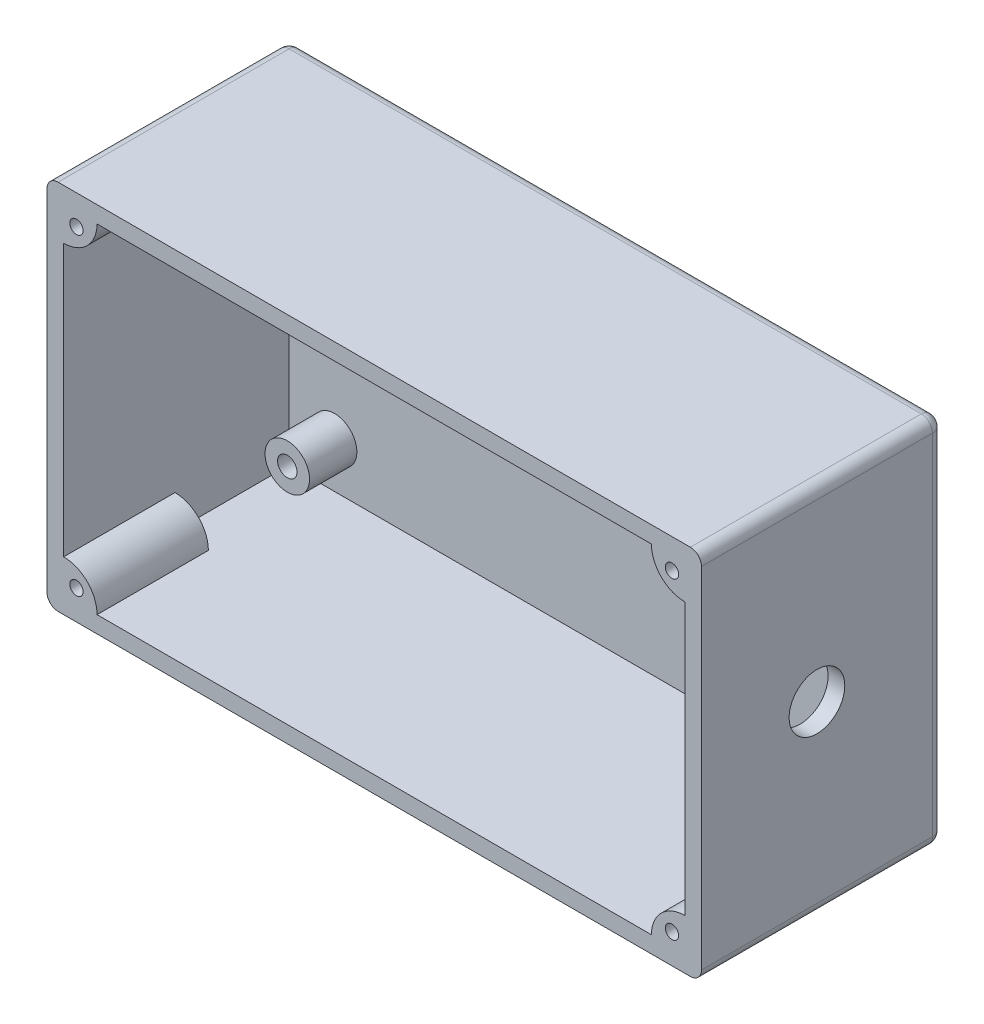
from build123d import *

# Parameters (mm, degrees)
SCHIZZO1_W                           = 117.6
SCHIZZO1_H                           = 66.8
ESTRUSIONE_ESTRUSIONE1_DEPTH         = 3
SCHIZZO2_W                           = 117.6
SCHIZZO2_H                           = 66.8
SCHIZZO2_W_2                         = 111.6
SCHIZZO2_H_2                         = 60.8
ESTRUSIONE_FORI_COVER_DEPTH          = 40.5
SCHIZZO4_R                           = 4
SCHIZZO4_R_2                         = 1.75
ESTRUSIONE_FORI_PCB_DEPTH            = 8.5
SCHIZZO7_R                           = 3.5
ESTRUSIONE_FORI_CHASSIS_DEPTH        = 1
SCHIZZO8_R                           = 1.85
TAGLIO_ESTRUSIONE2_DEPTH             = 79.82417142
TAGLIO_ESTRUSIONE2_DIRECTION_2_REACH = 80.824
RACCORDO3_R                          = 2
RACCORDO4_R                          = 2
RACCORDO5_R                          = 2
RACCORDO6_R                          = 2
RACCORDO7_R                          = 2
SCHIZZO9_R                           = 1.2
ESTRUSIONE_ESTRUSIONE6_DEPTH         = 20
TAGLIO_FORO_CAVI_REACH               = 131.76
SCHIZZO11_R                          = 5


with BuildPart() as part:
    # Schizzo1 → Estrusione-Estrusione1 (new body)
    with BuildSketch(Plane.XY):
        Rectangle(SCHIZZO1_W, SCHIZZO1_H)
    extrude(amount=ESTRUSIONE_ESTRUSIONE1_DEPTH)

    # Schizzo2 → Estrusione- Fori Cover (add)
    with BuildSketch(Plane.XY.offset(3)):
        Rectangle(SCHIZZO2_W, SCHIZZO2_H)
        Rectangle(SCHIZZO2_W_2, SCHIZZO2_H_2, mode=Mode.SUBTRACT)
    extrude(amount=ESTRUSIONE_FORI_COVER_DEPTH)

    # Schizzo4 → Estrusione- Fori PCB (add)
    # profile 1 of 4: a face of its own
    with BuildSketch(Plane.XY.offset(3)):
        with Locations(Location((-47.62, 22.2, 0), (0, 0, 180))):
            Circle(SCHIZZO4_R)
        with Locations((-47.62, 22.2)):
            Circle(SCHIZZO4_R_2, mode=Mode.SUBTRACT)
    # profile 2 of 4: a face of its own
    with BuildSketch(Plane.XY.offset(3)):
        with Locations(Location((47.63, 22.2, 0), (0, 0, 180))):
            Circle(SCHIZZO4_R)
        with Locations((47.63, 22.2)):
            Circle(SCHIZZO4_R_2, mode=Mode.SUBTRACT)
    # profile 3 of 4: a face of its own
    with BuildSketch(Plane.XY.offset(3)):
        with Locations(Location((47.63, -22.25, 0), (0, 0, 180))):
            Circle(SCHIZZO4_R)
        with Locations((47.63, -22.25)):
            Circle(SCHIZZO4_R_2, mode=Mode.SUBTRACT)
    # profile 4 of 4: a face of its own
    with BuildSketch(Plane.XY.offset(3)):
        with Locations(Location((-47.62, -22.25, 0), (0, 0, 180))):
            Circle(SCHIZZO4_R)
        with Locations((-47.62, -22.25)):
            Circle(SCHIZZO4_R_2, mode=Mode.SUBTRACT)
    extrude(amount=ESTRUSIONE_FORI_PCB_DEPTH)

    # Schizzo7 → Estrusione-Fori Chassis (add)
    with BuildSketch(Plane.XY.offset(3)):
        with Locations(Location((-48.8, 0, 0), (0, 0, 180))):
            Circle(SCHIZZO7_R)
        with Locations(Location((48.8, 0, 0), (0, 0, 180))):
            Circle(SCHIZZO7_R)
    extrude(amount=ESTRUSIONE_FORI_CHASSIS_DEPTH)

    # Schizzo8 → Taglio-Estrusione2 (cut)
    with BuildSketch(Plane.XY.offset(3)):
        with Locations((-48.8, 0)):
            Circle(SCHIZZO8_R)
        with Locations((48.8, 0)):
            Circle(SCHIZZO8_R)
    extrude(amount=-TAGLIO_ESTRUSIONE2_DEPTH, mode=Mode.SUBTRACT)

    # Schizzo8 → Taglio-Estrusione2 direction 2 (cut, up to next)
    with BuildSketch(Plane.XY.offset(3), mode=Mode.PRIVATE) as taglio_estrusione2_direction_2_sk1:
        with Locations((-48.8, 0)):
            Circle(SCHIZZO8_R)
    taglio_estrusione2_direction_2_tool1 = extrude(taglio_estrusione2_direction_2_sk1.sketch, amount=TAGLIO_ESTRUSIONE2_DIRECTION_2_REACH, mode=Mode.PRIVATE) & part.part
    # Schizzo8 → Taglio-Estrusione2 direction 2 (cut, up to next)
    with BuildSketch(Plane.XY.offset(3), mode=Mode.PRIVATE) as taglio_estrusione2_direction_2_sk2:
        with Locations((48.8, 0)):
            Circle(SCHIZZO8_R)
    taglio_estrusione2_direction_2_tool2 = extrude(taglio_estrusione2_direction_2_sk2.sketch, amount=TAGLIO_ESTRUSIONE2_DIRECTION_2_REACH, mode=Mode.PRIVATE) & part.part
    add(taglio_estrusione2_direction_2_tool1.solids().sort_by_distance((-48.8, 0, 3))[0], mode=Mode.SUBTRACT)
    add(taglio_estrusione2_direction_2_tool2.solids().sort_by_distance((48.8, 0, 3))[0], mode=Mode.SUBTRACT)

    # Raccordo3
    raccordo3_edges = [part.edges().sort_by_distance(p)[0] for p in [
        (-58.8, 33.4, 21.75),
    ]]
    fillet(raccordo3_edges, radius=RACCORDO3_R)

    # Raccordo4
    raccordo4_edges = [part.edges().sort_by_distance(p)[0] for p in [
        (58.8, 33.4, 21.75),
    ]]
    fillet(raccordo4_edges, radius=RACCORDO4_R)

    # Raccordo5
    raccordo5_edges = [part.edges().sort_by_distance(p)[0] for p in [
        (-58.8, -33.4, 21.75),
    ]]
    fillet(raccordo5_edges, radius=RACCORDO5_R)

    # Raccordo6
    raccordo6_edges = [part.edges().sort_by_distance(p)[0] for p in [
        (58.8, -33.4, 21.75),
    ]]
    fillet(raccordo6_edges, radius=RACCORDO6_R)

    # Raccordo7
    raccordo7_edges = [part.edges().sort_by_distance(p)[0] for p in [
        (0, -33.4, 0),
        (-58.214213562, -32.814213562, 0),
        (58.8, 0, 0),
        (58.214213562, -32.814213562, 0),
        (-58.8, 0, 0),
        (-58.214213562, 32.814213562, 0),
        (0, 33.4, 0),
        (58.214213562, 32.814213562, 0),
    ]]
    fillet(raccordo7_edges, radius=RACCORDO7_R)

    # Schizzo9 → Estrusione-Estrusione6 (add)
    # profile 1 of 4: a face of its own
    with BuildSketch(Plane.XY.offset(43.5)):
        with BuildLine():
            Line((-55.8, 24.4), (-55.8, 30.4))
            Line((-55.8, 30.4), (-49.8, 30.4))
            ThreePointArc((-49.8, 30.4), (-51.557359313, 26.157359313), (-55.8, 24.4))
        make_face()
        with Locations((-53.5, 28.1)):
            Circle(SCHIZZO9_R, mode=Mode.SUBTRACT)
    # profile 2 of 4: a face of its own
    with BuildSketch(Plane.XY.offset(43.5)):
        with BuildLine():
            Line((49.8, 30.4), (55.8, 30.4))
            Line((55.8, 30.4), (55.8, 24.4))
            ThreePointArc((55.8, 24.4), (51.557359313, 26.157359313), (49.8, 30.4))
        make_face()
        with Locations((53.5, 28.1)):
            Circle(SCHIZZO9_R, mode=Mode.SUBTRACT)
    # profile 3 of 4: a face of its own
    with BuildSketch(Plane.XY.offset(43.5)):
        with BuildLine():
            Line((55.8, -24.4), (55.8, -30.4))
            Line((55.8, -30.4), (49.8, -30.4))
            ThreePointArc((49.8, -30.4), (51.557359313, -26.157359313), (55.8, -24.4))
        make_face()
        with Locations((53.5, -28.1)):
            Circle(SCHIZZO9_R, mode=Mode.SUBTRACT)
    # profile 4 of 4: a face of its own
    with BuildSketch(Plane.XY.offset(43.5)):
        with BuildLine():
            Line((-55.8, -24.4), (-55.8, -30.4))
            Line((-55.8, -30.4), (-49.8, -30.4))
            ThreePointArc((-49.8, -30.4), (-51.557359313, -26.157359313), (-55.8, -24.4))
        make_face()
        with Locations((-53.5, -28.1)):
            Circle(SCHIZZO9_R, mode=Mode.SUBTRACT)
    extrude(amount=-ESTRUSIONE_ESTRUSIONE6_DEPTH)

    # Schizzo11 → Taglio- Foro Cavi (cut, up to next)
    with BuildSketch(Plane(origin=(58.8, 0, 0), x_dir=(0, 0, -1), z_dir=(1, 0, 0)), mode=Mode.PRIVATE) as taglio_foro_cavi_sk1:
        with Locations((-22.75, 0)):
            Circle(SCHIZZO11_R)
    taglio_foro_cavi_tool1 = extrude(taglio_foro_cavi_sk1.sketch, amount=-TAGLIO_FORO_CAVI_REACH, mode=Mode.PRIVATE) & part.part
    add(taglio_foro_cavi_tool1.solids().sort_by_distance((58.8, 0, 22.75))[0], mode=Mode.SUBTRACT)


solid = part.part
